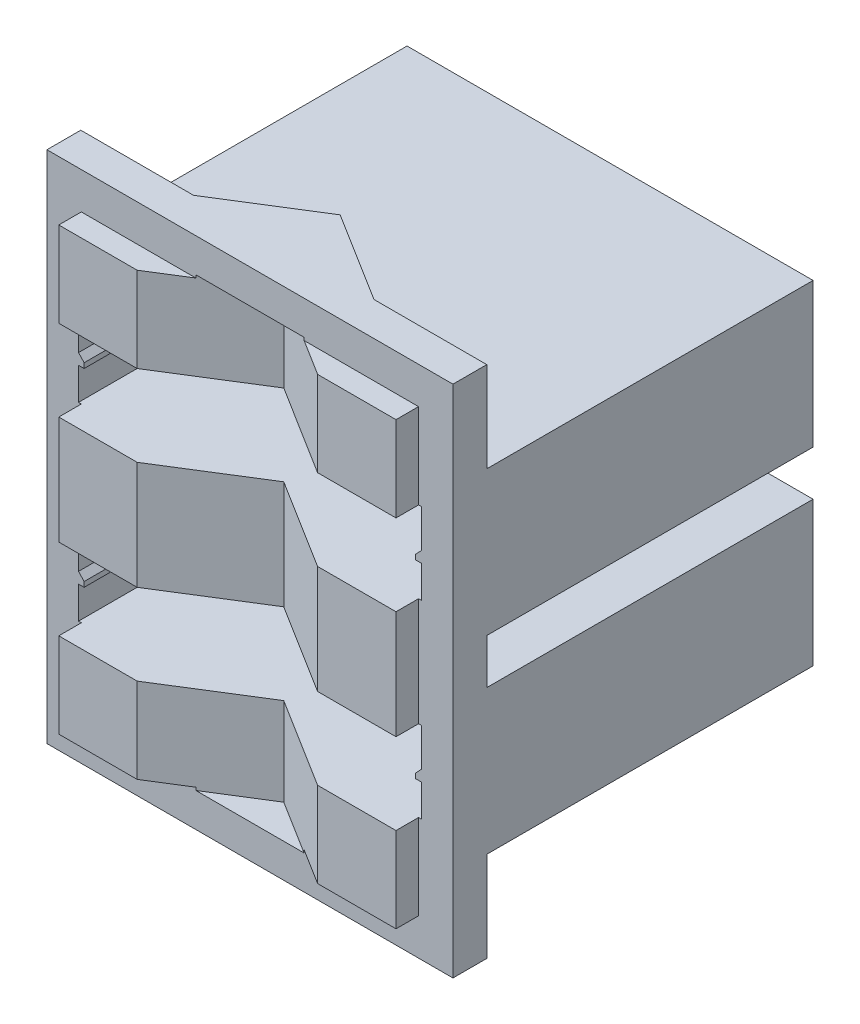
from build123d import *

# Parameters (mm, degrees)
SKETCH1_W           = 35.999968648
SKETCH1_H           = 39.60056603
BOSS_EXTRUDE1_DEPTH = 33.93
SKETCH2_W           = 28.93
SKETCH2_H           = 5
SKETCH2_H_2         = 4
CUT_EXTRUDE1_DEPTH  = 64.367558518
SKETCH3_W           = 16
SKETCH3_H           = 5
SKETCH3_H_2         = 4
CUT_EXTRUDE2_DEPTH  = 64.367558518
CUT_EXTRUDE3_DEPTH  = 61.369212453
SKETCH5_W           = 30.4
SKETCH5_H           = 7.2
CUT_EXTRUDE4_DEPTH  = 30.93
CUT_EXTRUDE5_DEPTH  = 62.813165851
BOSS_EXTRUDE2_REACH = 65.368
BOSS_EXTRUDE3_DEPTH = 5
BOSS_EXTRUDE4_REACH = 56.06
BOSS_EXTRUDE5_DEPTH = 5
BOSS_EXTRUDE6_DEPTH = 3
SKETCH12_W          = 35.999968648
SKETCH12_H          = 45.60056603
CUT_EXTRUDE6_DEPTH  = 2
SKETCH13_W          = 30.4
SKETCH13_H          = 39.6
SKETCH13_W_2        = 29.9
SKETCH13_H_2        = 39.1
CUT_EXTRUDE7_DEPTH  = 2


with BuildPart() as part:
    # Sketch1 → Boss-Extrude1 (new body)
    with BuildSketch(Plane.XY):
        with Locations((17.999984324, 19.800283015)):
            Rectangle(SKETCH1_W, SKETCH1_H)
    extrude(amount=-BOSS_EXTRUDE1_DEPTH)

    # Sketch2 → Cut-Extrude1 (cut, through all)
    with BuildSketch(Plane(origin=(35.999968648, 0, 0), x_dir=(0, 0, -1), z_dir=(1, 0, 0))):
        with Locations((19.465, 37.10056603)):
            Rectangle(SKETCH2_W, SKETCH2_H)
        with Locations((19.465, 19.800283015)):
            Rectangle(SKETCH2_W, SKETCH2_H_2)
        with Locations((19.465, 2.5)):
            Rectangle(SKETCH2_W, SKETCH2_H)
    extrude(amount=-CUT_EXTRUDE1_DEPTH, mode=Mode.SUBTRACT)

    # Sketch3 → Cut-Extrude2 (cut, through all)
    with BuildSketch(Plane.XY):
        with Locations((17.999984324, 37.10056603)):
            Rectangle(SKETCH3_W, SKETCH3_H)
        with Locations((17.999984324, 19.800283015)):
            Rectangle(SKETCH3_W, SKETCH3_H_2)
        with Locations((17.999984324, 2.5)):
            Rectangle(SKETCH3_W, SKETCH3_H)
    extrude(amount=-CUT_EXTRUDE2_DEPTH, mode=Mode.SUBTRACT)

    # Sketch4 → Cut-Extrude3 (cut, through all)
    with BuildSketch(Plane(origin=(0, 34.60056603, 0), x_dir=(1, 0, 0), z_dir=(0, 1, 0))):
        Polygon((9.999984324, 0), (17.999984324, 5), (25.999984324, 0), align=None)
    extrude(amount=-CUT_EXTRUDE3_DEPTH, mode=Mode.SUBTRACT)

    # Sketch5 → Cut-Extrude4 (cut)
    with BuildSketch(Plane.XY):
        with Locations((17.999984324, 11.4)):
            Rectangle(SKETCH5_W, SKETCH5_H)
        with Locations((17.999984324, 28.20056603)):
            Rectangle(SKETCH5_W, SKETCH5_H)
    extrude(amount=-CUT_EXTRUDE4_DEPTH, mode=Mode.SUBTRACT)

    # Sketch6 → Cut-Extrude5 (cut, through all)
    with BuildSketch(Plane.XY.offset(-30.93)):
        with BuildLine():
            Line((15.109984324, 29.66056603), (20.889984324, 29.66056603))
            ThreePointArc((20.889984324, 29.66056603), (22.469984324, 28.08056603), (20.889984324, 26.50056603))
            Line((20.889984324, 26.50056603), (15.109984324, 26.50056603))
            ThreePointArc((15.109984324, 26.50056603), (13.529984324, 28.08056603), (15.109984324, 29.66056603))
        make_face()
        with BuildLine():
            Line((15.109984324, 12.86), (20.889984324, 12.86))
            ThreePointArc((20.889984324, 12.86), (22.469984324, 11.28), (20.889984324, 9.7))
            Line((20.889984324, 9.7), (15.109984324, 9.7))
            ThreePointArc((15.109984324, 9.7), (13.529984324, 11.28), (15.109984324, 12.86))
        make_face()
    extrude(amount=-CUT_EXTRUDE5_DEPTH, mode=Mode.SUBTRACT)

    # Sketch7 → Boss-Extrude2 (add, up to next)
    with BuildSketch(Plane.XY, mode=Mode.PRIVATE) as boss_extrude2_sk1:
        Polygon((2.799984324, 28.422935376), (2.799984324, 27.45056603), (3.299984324, 27.45056603), (3.299984324, 27.896781183), align=None)
    boss_extrude2_tool1 = extrude(boss_extrude2_sk1.sketch, amount=-BOSS_EXTRUDE2_REACH, mode=Mode.PRIVATE) - part.part
    # Sketch7 → Boss-Extrude2 (add, up to next)
    with BuildSketch(Plane.XY, mode=Mode.PRIVATE) as boss_extrude2_sk2:
        Polygon((2.799984324, 11.622369346), (2.799984324, 10.65), (3.299984324, 10.65), (3.299984324, 11.096215154), align=None)
    boss_extrude2_tool2 = extrude(boss_extrude2_sk2.sketch, amount=-BOSS_EXTRUDE2_REACH, mode=Mode.PRIVATE) - part.part
    boss_extrude2_1 = boss_extrude2_tool1.solids().sort_by_distance((3.019076, 27.821475, 0))[0]
    add(boss_extrude2_1)
    boss_extrude2_2 = boss_extrude2_tool2.solids().sort_by_distance((3.019076, 11.020909, 0))[0]
    add(boss_extrude2_2)
    boss_extrude2 = boss_extrude2_1 + boss_extrude2_2  # Boss-Extrude2 as one shape, for the pattern or mirror that repeats it

    # Mirror1: Boss-Extrude2 across plane
    add(boss_extrude2.mirror(Plane(origin=(17.999984324, 0, 0), x_dir=(0, 0, 1), z_dir=(1, 0, 0))))

    # Sketch8 → Boss-Extrude3 (add)
    with BuildSketch(Plane(origin=(0, 34.60056603, 0), x_dir=(1, 0, 0), z_dir=(0, 1, 0))):
        Polygon((9.999984324, 5), (17.999984324, 10), (25.999984324, 5), (25.999984324, 0), (17.999984324, 5), (9.999984324, 0), align=None)
    extrude(amount=BOSS_EXTRUDE3_DEPTH)

    # Sketch9 → Boss-Extrude4 (add, up to next)
    with BuildSketch(Plane(origin=(0, 17.800283015, 0), x_dir=(1, 0, 0), z_dir=(0, 1, 0)), mode=Mode.PRIVATE) as boss_extrude4_sk1:
        Polygon((9.999984324, 5), (17.999984324, 10), (25.999984324, 5), (25.999984324, 0), (17.999984324, 5), (9.999984324, 0), align=None)
    boss_extrude4_tool1 = extrude(boss_extrude4_sk1.sketch, amount=BOSS_EXTRUDE4_REACH, mode=Mode.PRIVATE) - part.part
    add(boss_extrude4_tool1.solids().sort_by_distance((14.099984, 17.800283, -7.34))[0])

    # Sketch10 → Boss-Extrude5 (add)
    with BuildSketch(Plane.XZ.offset(-5)):
        Polygon((9.999984324, 0), (17.999984324, -5), (25.999984324, 0), (25.999984324, -5), (17.999984324, -10), (9.999984324, -5), align=None)
    extrude(amount=BOSS_EXTRUDE5_DEPTH)

    # Sketch11 → Boss-Extrude6 (add)
    with BuildSketch(Plane(origin=(0, 39.60056603, 0), x_dir=(1, 0, 0), z_dir=(0, 1, 0))):
        Polygon((0, 5), (9.999984324, 5), (17.999984324, 10), (25.999984324, 5), (35.999968648, 5), (35.999968648, 0), (0, 0), align=None)
    boss_extrude6 = extrude(amount=BOSS_EXTRUDE6_DEPTH)

    # Mirror2: Boss-Extrude6 across plane
    add(boss_extrude6.mirror(Plane.ZX.offset(19.800283015)))

    # Sketch12 → Cut-Extrude6 (cut)
    with BuildSketch(Plane.XY):
        with Locations((17.999984324, 19.800283015)):
            Rectangle(SKETCH12_W, SKETCH12_H)
        Polygon((2.799984324, 39.600283015), (33.199984324, 39.600283015), (33.199984324, 28.422935376), (32.699984324, 27.896781183), (32.699984324, 27.45056603), (33.199984324, 27.45056603), (33.199984324, 11.622369346), (32.699984324, 11.096215154), (32.699984324, 10.65), (33.199984324, 10.65), (33.199984324, 0.000283015), (2.799984324, 0.000283015), (2.799984324, 10.65), (3.299984324, 10.65), (3.299984324, 11.096215154), (2.799984324, 11.622369346), (2.799984324, 27.45056603), (3.299984324, 27.45056603), (3.299984324, 27.896781183), (2.799984324, 28.422935376), align=None, mode=Mode.SUBTRACT)
    extrude(amount=-CUT_EXTRUDE6_DEPTH, mode=Mode.SUBTRACT)

    # Sketch13 → Cut-Extrude7 (cut)
    with BuildSketch(Plane.XY):
        with Locations((17.999984324, 19.800283015)):
            Rectangle(SKETCH13_W, SKETCH13_H)
        with Locations((17.999984324, 19.800283015)):
            Rectangle(SKETCH13_W_2, SKETCH13_H_2, mode=Mode.SUBTRACT)
    extrude(amount=-CUT_EXTRUDE7_DEPTH, mode=Mode.SUBTRACT)


solid = part.part
